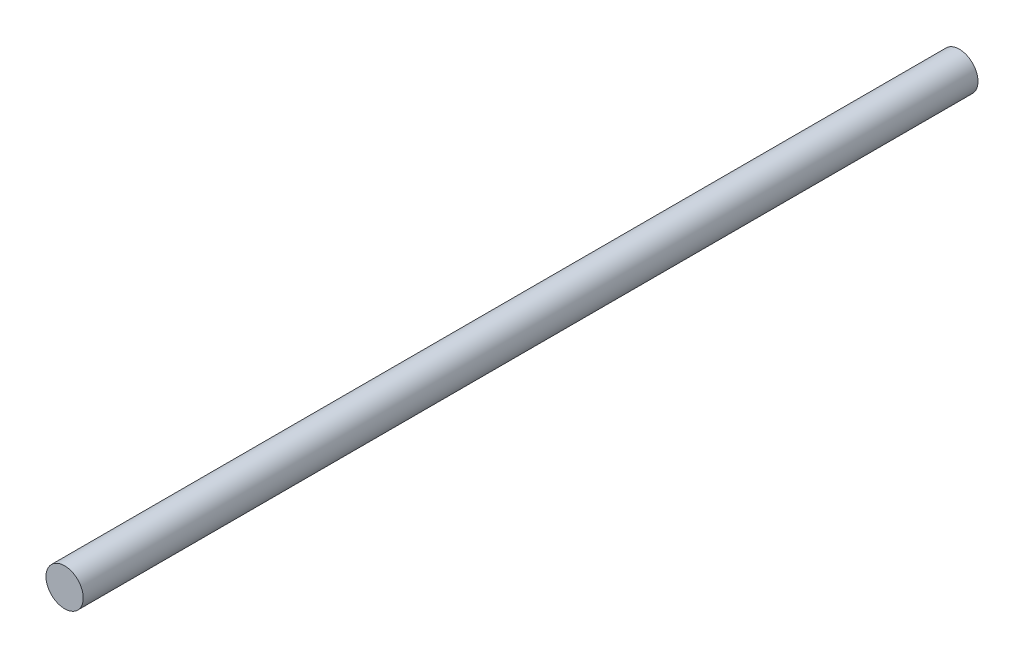
from build123d import *

# Parameters (mm, degrees)
ESQUISSE1_R        = 5
BOSS_EXTRU_1_DEPTH = 240


with BuildPart() as part:
    # Esquisse1 → Boss.-Extru.1 (new body)
    with BuildSketch(Plane.XY):
        Circle(ESQUISSE1_R)
    extrude(amount=BOSS_EXTRU_1_DEPTH)


solid = part.part
